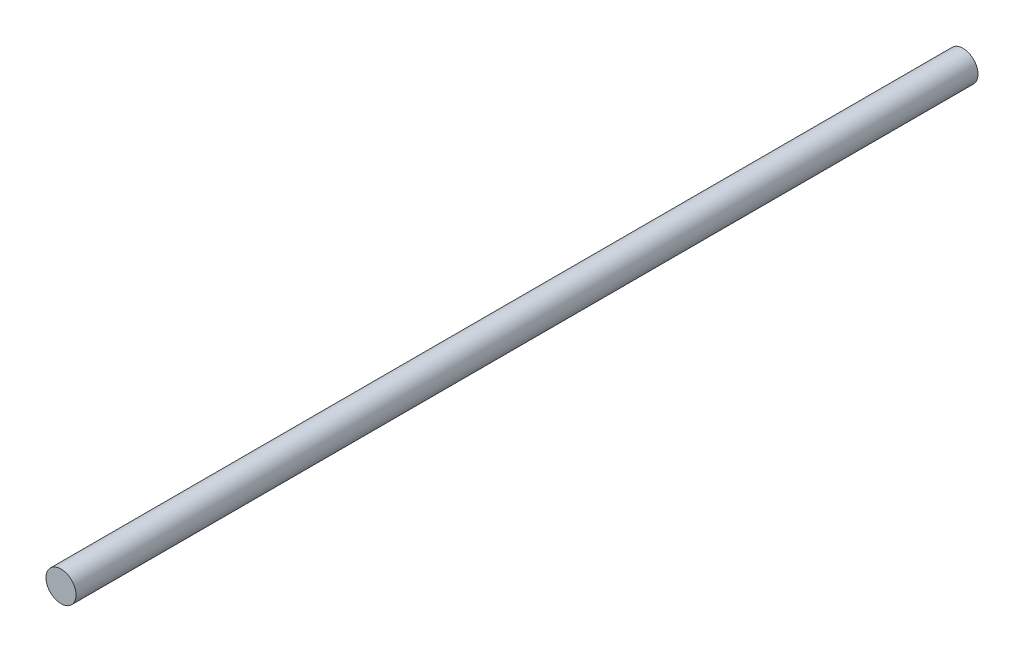
from build123d import *

# Parameters (mm, degrees)
ESQUISSE1_R        = 20
BOSS_EXTRU_1_DEPTH = 1200


with BuildPart() as part:
    # Esquisse1 → Boss.-Extru.1 (new body)
    with BuildSketch(Plane.XY):
        Circle(ESQUISSE1_R)
    extrude(amount=BOSS_EXTRU_1_DEPTH)


solid = part.part
